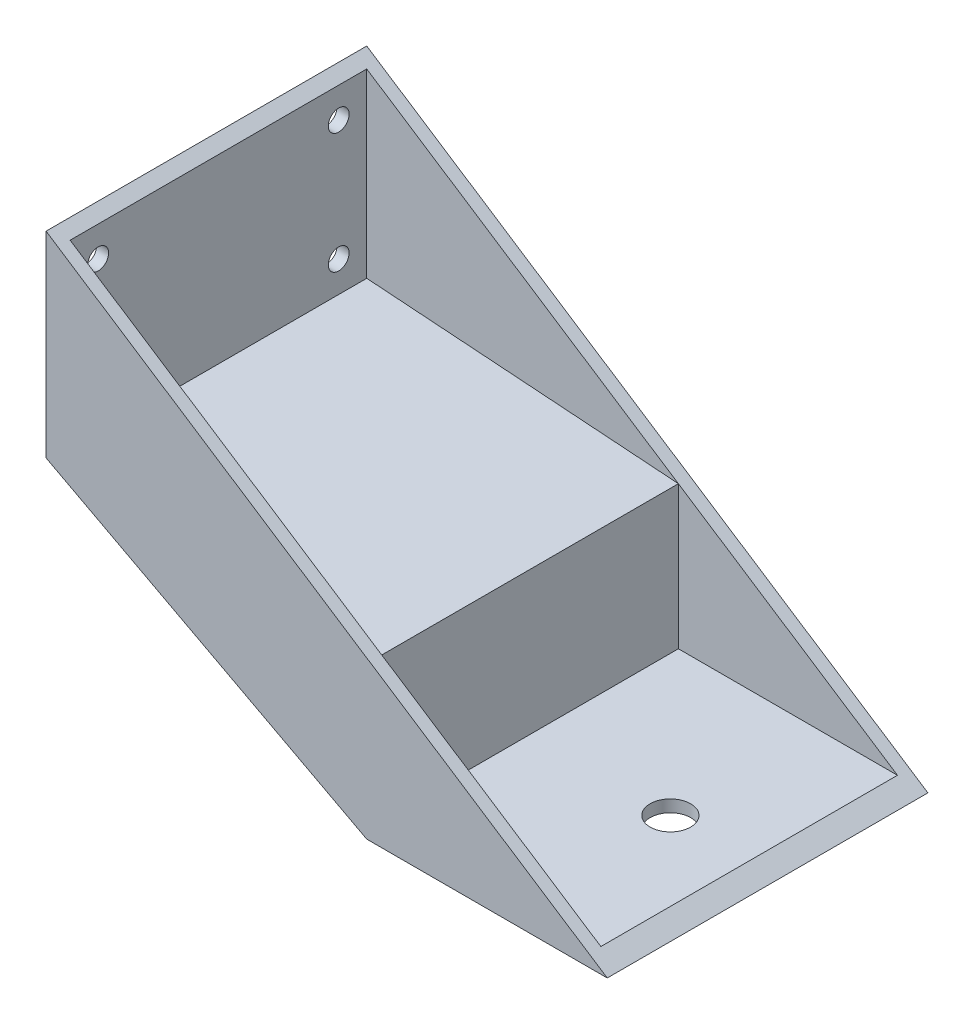
from build123d import *

# Parameters (mm, degrees)
EXTRUDE_3_DEPTH     = 80
SHELL_14_T          = -3
CUT_EXTRUDE_1_REACH = 170.526
SKETCH_9_R          = 2.6
EXTRUDE_7_REACH     = 169.123
CUT_EXTRUDE_2_REACH = 185.868
SKETCH_24_R         = 5.05


with BuildPart() as part:
    # 草图5 → 凸台-拉伸3 (new body)
    with BuildSketch(Plane.XY):
        Polygon((0, 49), (0, 0), (80, -42.359693068), (140, -42.359693068), align=None)
    extrude(amount=EXTRUDE_3_DEPTH)

    # 抽壳14
    shell_14_openings = [part.faces().sort_by_distance(p)[0] for p in [
        (70, 3.320153466, 40),
    ]]
    offset(amount=SHELL_14_T, openings=shell_14_openings, kind=Kind.INTERSECTION)

    # 草图9 → 切除-拉伸1 (cut, up to next)
    with BuildSketch(Plane.ZY, mode=Mode.PRIVATE) as cut_extrude_1_sk1:
        with Locations(Location((70, 9.5, 0), (0, 0, 270))):
            Circle(SKETCH_9_R)
    cut_extrude_1_tool1 = extrude(cut_extrude_1_sk1.sketch, amount=-CUT_EXTRUDE_1_REACH, mode=Mode.PRIVATE) & part.part
    # 草图9 → 切除-拉伸1 (cut, up to next)
    with BuildSketch(Plane.ZY, mode=Mode.PRIVATE) as cut_extrude_1_sk2:
        with Locations(Location((70, 39.5, 0), (0, 0, 270))):
            Circle(SKETCH_9_R)
    cut_extrude_1_tool2 = extrude(cut_extrude_1_sk2.sketch, amount=-CUT_EXTRUDE_1_REACH, mode=Mode.PRIVATE) & part.part
    # 草图9 → 切除-拉伸1 (cut, up to next)
    with BuildSketch(Plane.ZY, mode=Mode.PRIVATE) as cut_extrude_1_sk3:
        with Locations(Location((10, 9.5, 0), (0, 0, 270))):
            Circle(SKETCH_9_R)
    cut_extrude_1_tool3 = extrude(cut_extrude_1_sk3.sketch, amount=-CUT_EXTRUDE_1_REACH, mode=Mode.PRIVATE) & part.part
    # 草图9 → 切除-拉伸1 (cut, up to next)
    with BuildSketch(Plane.ZY, mode=Mode.PRIVATE) as cut_extrude_1_sk4:
        with Locations(Location((10, 39.5, 0), (0, 0, 270))):
            Circle(SKETCH_9_R)
    cut_extrude_1_tool4 = extrude(cut_extrude_1_sk4.sketch, amount=-CUT_EXTRUDE_1_REACH, mode=Mode.PRIVATE) & part.part
    add(cut_extrude_1_tool1.solids().sort_by_distance((0, 9.5, 70))[0], mode=Mode.SUBTRACT)
    add(cut_extrude_1_tool2.solids().sort_by_distance((0, 39.5, 70))[0], mode=Mode.SUBTRACT)
    add(cut_extrude_1_tool3.solids().sort_by_distance((0, 9.5, 10))[0], mode=Mode.SUBTRACT)
    add(cut_extrude_1_tool4.solids().sort_by_distance((0, 39.5, 10))[0], mode=Mode.SUBTRACT)

    # 草图23 → 凸台-拉伸7 (add, up to next)
    with BuildSketch(Plane.XY.offset(3), mode=Mode.PRIVATE) as extrude_7_sk1:
        Polygon((80.745233001, -39.359693068), (80.745233001, -3.691855026), (3, 1.806109525), align=None)
    extrude_7_tool1 = extrude(extrude_7_sk1.sketch, amount=EXTRUDE_7_REACH, mode=Mode.PRIVATE) - part.part
    add(extrude_7_tool1.solids().sort_by_distance((54.830155, -13.74848, 3))[0])

    # 草图24 → 切除-拉伸2 (cut, up to next)
    with BuildSketch(Plane(origin=(0, -39.359693068, 0), x_dir=(1, 0, 0), z_dir=(0, 1, 0)), mode=Mode.PRIVATE) as cut_extrude_2_sk1:
        with Locations(Location((115.745233001, -40, 0), (0, 0, 270))):
            Circle(SKETCH_24_R)
    cut_extrude_2_tool1 = extrude(cut_extrude_2_sk1.sketch, amount=-CUT_EXTRUDE_2_REACH, mode=Mode.PRIVATE) & part.part
    add(cut_extrude_2_tool1.solids().sort_by_distance((115.745233, -39.359693, 40))[0], mode=Mode.SUBTRACT)


solid = part.part
